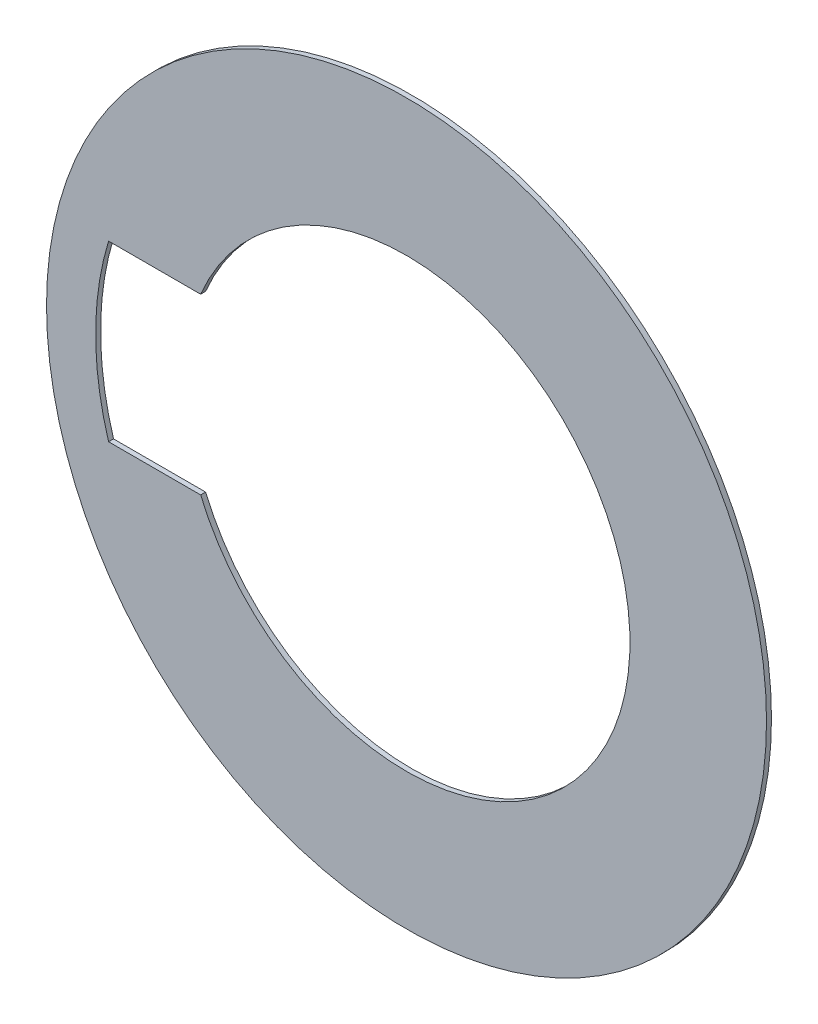
from build123d import *

# Parameters (mm, degrees)
SKETCH1_R               = 184.15
BOSS_EXTRUDE1_DEPTH     = 2.54
CUT_EXTRUDE1_DEPTH      = 261.439813777
CUT_EXTRUDE1_DEPTH_BACK = 261.439813777


with BuildPart() as part:
    # Sketch1 → Boss-Extrude1 (new body)
    with BuildSketch(Plane.XY):
        Circle(SKETCH1_R)
    extrude(amount=BOSS_EXTRUDE1_DEPTH)

    # Sketch2 → Cut-Extrude1 (cut, two sides: drawn at the far end of the back side and taken through both)
    with BuildSketch(Plane.XY.offset(2.54).offset(-CUT_EXTRUDE1_DEPTH_BACK)):
        with BuildLine():
            Line((-105.302837094, -44.45), (-152.4, -44.45))
            ThreePointArc((-152.4, -44.45), (-159.026348403, 0), (-152.4, 44.45))
            Line((-152.4, 44.45), (-105.302837094, 44.45))
            ThreePointArc((-105.302837094, 44.45), (114.3, 0), (-105.302837094, -44.45))
        make_face()
    extrude(amount=CUT_EXTRUDE1_DEPTH + CUT_EXTRUDE1_DEPTH_BACK, mode=Mode.SUBTRACT)


solid = part.part
